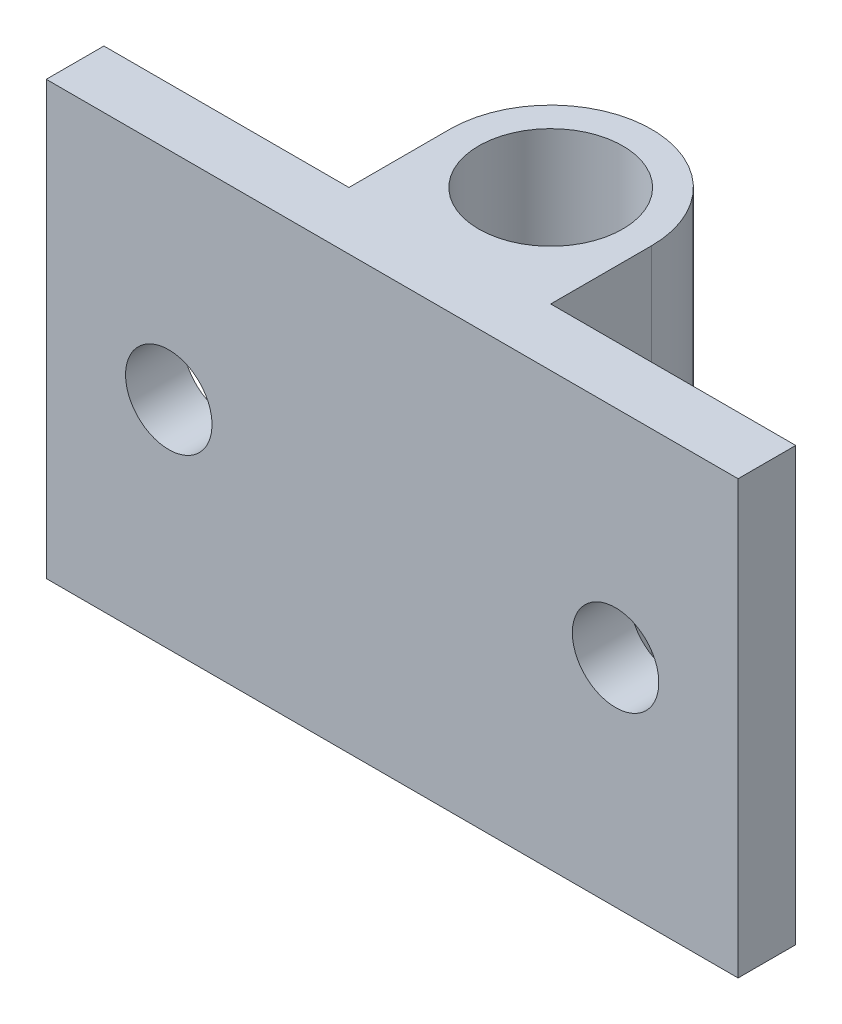
from build123d import *

# Parameters (mm, degrees)
BOSS_EXTRUDE1_DEPTH = 15
CUT_EXTRUDE1_DEPTH  = 21.4450483


with BuildPart() as part:
    # Sketch1 → Boss-Extrude1 (new body)
    with BuildSketch(Plane(origin=(0, 0, 0), x_dir=(1, 0, 0), z_dir=(0, 1, 0))):
        with BuildLine():
            ThreePointArc((0, 2.5), (1.767766953, 1.767766953), (2.5, 0))
            Line((2.5, 0), (3.5, 0))
            ThreePointArc((3.5, 0), (2.474873734, 2.474873734), (0, 3.5))
            Line((0, 3.5), (0, 2.5))
        make_face()
        with BuildLine():
            Line((-3.5, 0), (-2.5, 0))
            ThreePointArc((-2.5, 0), (-1.767766953, 1.767766953), (0, 2.5))
            Line((0, 2.5), (0, 3.5))
            ThreePointArc((0, 3.5), (-2.474873734, 2.474873734), (-3.5, 0))
        make_face()
        with BuildLine():
            Line((0, -5.5), (0, -2.5))
            ThreePointArc((0, -2.5), (-1.767766953, -1.767766953), (-2.5, 0))
            Line((-2.5, 0), (-3.5, 0))
            Line((-3.5, 0), (-3.5, -3.5))
            Line((-3.5, -3.5), (-12, -3.5))
            Line((-12, -3.5), (-12, -5.5))
            Line((-12, -5.5), (0, -5.5))
        make_face()
        with BuildLine():
            ThreePointArc((2.5, 0), (1.767766953, -1.767766953), (0, -2.5))
            Line((0, -2.5), (0, -5.5))
            Line((0, -5.5), (12, -5.5))
            Line((12, -5.5), (12, -3.5))
            Line((12, -3.5), (3.5, -3.5))
            Line((3.5, -3.5), (3.5, 0))
            Line((3.5, 0), (2.5, 0))
        make_face()
    extrude(amount=BOSS_EXTRUDE1_DEPTH)

    # Sketch2 → Cut-Extrude1 (cut, through all)
    with BuildSketch(Plane(origin=(0, 0, 3.5), x_dir=(-1, 0, 0), z_dir=(0, 0, -1))):
        with BuildLine():
            ThreePointArc((-6.25, 7.5), (-6.689339828, 8.560660172), (-7.75, 9))
            Line((-7.75, 9), (-7.75, 6))
            ThreePointArc((-7.75, 6), (-6.689339828, 6.439339828), (-6.25, 7.5))
        make_face()
        with BuildLine():
            Line((-7.75, 6), (-7.75, 9))
            ThreePointArc((-7.75, 9), (-9.25, 7.5), (-7.75, 6))
        make_face()
        with BuildLine():
            ThreePointArc((9.25, 7.5), (8.810660172, 8.560660172), (7.75, 9))
            Line((7.75, 9), (7.75, 6))
            ThreePointArc((7.75, 6), (8.810660172, 6.439339828), (9.25, 7.5))
        make_face()
        with BuildLine():
            Line((7.75, 6), (7.75, 9))
            ThreePointArc((7.75, 9), (6.25, 7.5), (7.75, 6))
        make_face()
    extrude(amount=-CUT_EXTRUDE1_DEPTH, mode=Mode.SUBTRACT)


solid = part.part
